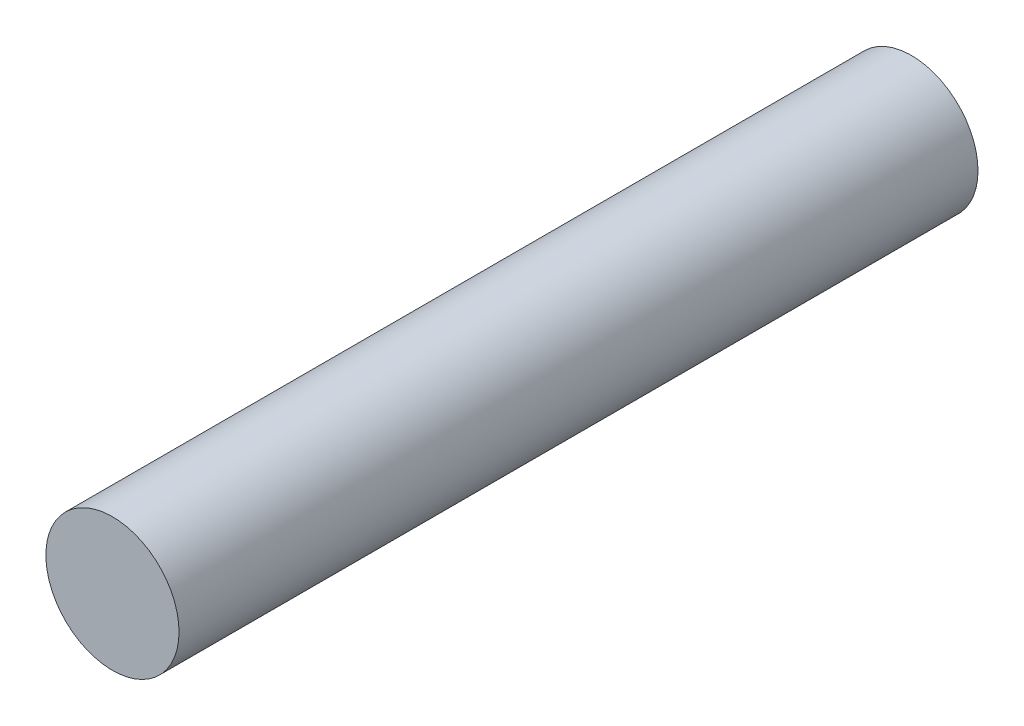
from build123d import *

# Parameters (mm, degrees)
SKETCH2_R           = 0.1875
BOSS_EXTRUDE1_DEPTH = 2.25


with BuildPart() as part:
    # Sketch2 → Boss-Extrude1 (new body)
    with BuildSketch(Plane.XY):
        Circle(SKETCH2_R)
    extrude(amount=BOSS_EXTRUDE1_DEPTH)


solid = part.part
